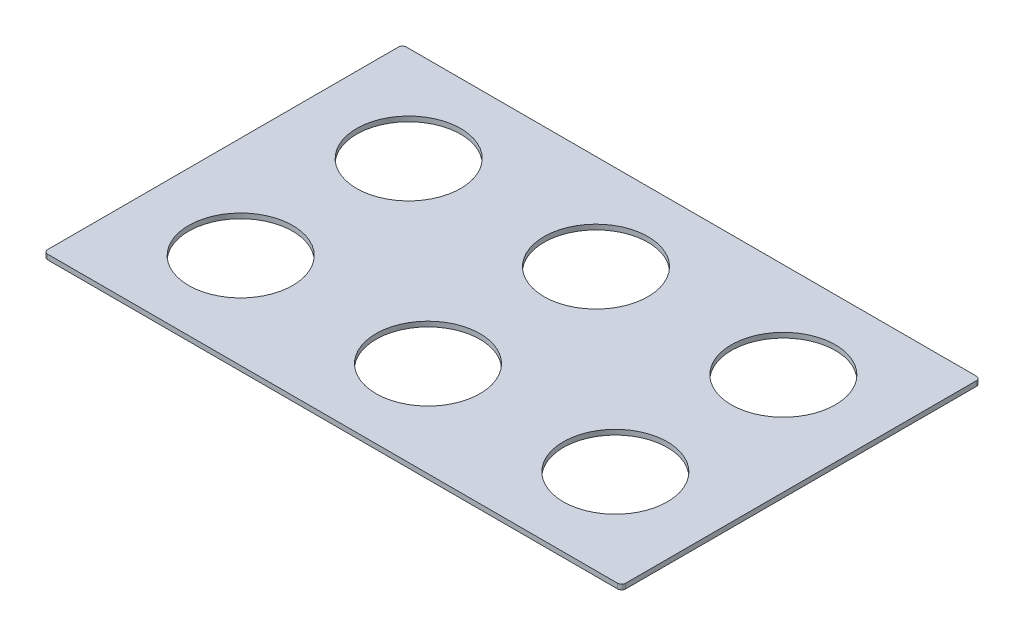
from build123d import *

# Parameters (mm, degrees)
SKETCH1_W           = 368.3
SKETCH1_H           = 228.6
SKETCH1_R           = 33.147
BOSS_EXTRUDE1_DEPTH = 3.175
FILLET1_R           = 2.54


with BuildPart() as part:
    # Sketch1 → Boss-Extrude1 (new body)
    with BuildSketch(Plane(origin=(0, 0, 0), x_dir=(1, 0, 0), z_dir=(0, 1, 0))):
        Rectangle(SKETCH1_W, SKETCH1_H)
        with Locations(Location((119.38, 53.5305, 0), (0, 0, 270))):
            Circle(SKETCH1_R, mode=Mode.SUBTRACT)
        with Locations(Location((0, 53.5305, 0), (0, 0, 270))):
            Circle(SKETCH1_R, mode=Mode.SUBTRACT)
        with Locations(Location((-119.38, 53.5305, 0), (0, 0, 270))):
            Circle(SKETCH1_R, mode=Mode.SUBTRACT)
        with Locations(Location((-119.38, -53.5305, 0), (0, 0, 270))):
            Circle(SKETCH1_R, mode=Mode.SUBTRACT)
        with Locations(Location((0, -53.5305, 0), (0, 0, 270))):
            Circle(SKETCH1_R, mode=Mode.SUBTRACT)
        with Locations(Location((119.38, -53.5305, 0), (0, 0, 270))):
            Circle(SKETCH1_R, mode=Mode.SUBTRACT)
    extrude(amount=BOSS_EXTRUDE1_DEPTH)

    # Fillet1
    fillet1_edges = [part.edges().sort_by_distance(p)[0] for p in [
        (184.15, 1.5875, 114.3),
        (-184.15, 1.5875, 114.3),
        (-184.15, 1.5875, -114.3),
        (184.15, 1.5875, -114.3),
    ]]
    fillet(fillet1_edges, radius=FILLET1_R)


solid = part.part
